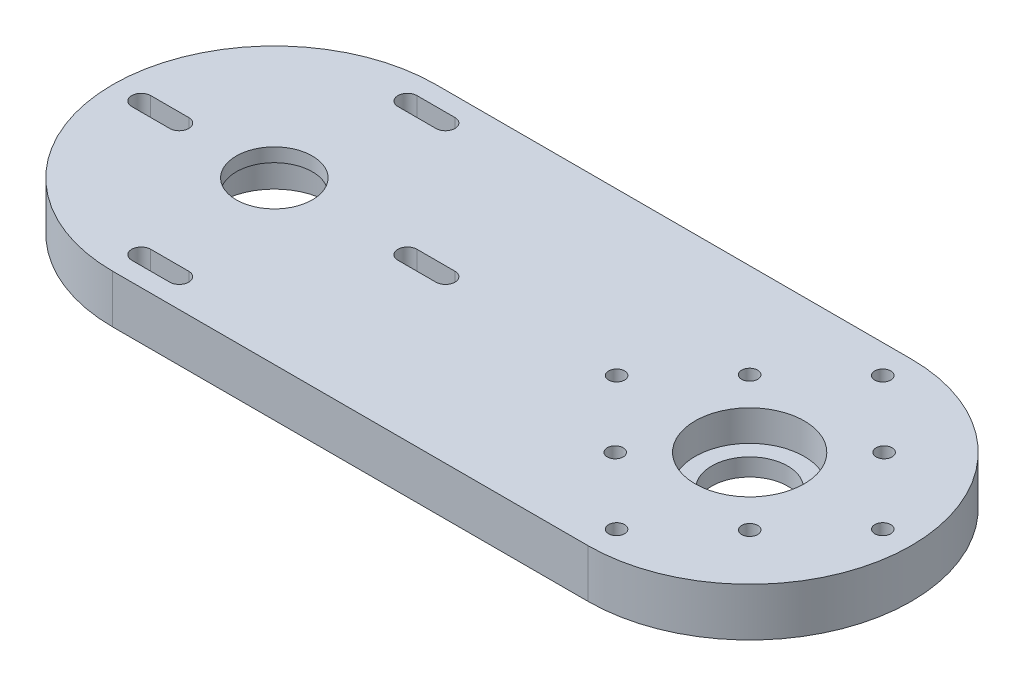
from build123d import *

# Parameters (mm, degrees)
SKETCH1_R           = 10
SKETCH1_R_2         = 2.1
BOSS_EXTRUDE1_DEPTH = 12.7
SKETCH2_R           = 14.35
CUT_EXTRUDE1_DEPTH  = 8.1
CUT_EXTRUDE2_START  = -12.7
SKETCH3_R           = 14.35
CUT_EXTRUDE2_DEPTH  = 9.1
CUT_EXTRUDE3_START  = -12.7
CUT_EXTRUDE3_DEPTH  = 5


with BuildPart() as part:
    # Sketch1 → Boss-Extrude1 (new body)
    with BuildSketch(Plane(origin=(0, 0, 0), x_dir=(1, 0, 0), z_dir=(0, 1, 0))):
        with BuildLine():
            ThreePointArc((-125, 42.5), (-167.5, 0), (-125, -42.5))
            Line((-125, -42.5), (0, -42.5))
            ThreePointArc((0, -42.5), (42.5, 0), (0, 42.5))
            Line((0, 42.5), (-125, 42.5))
        make_face()
        with BuildLine():
            Line((-90, 2.5), (-80, 2.5))
            ThreePointArc((-80, 2.5), (-77.5, 0), (-80, -2.5))
            Line((-80, -2.5), (-90, -2.5))
            ThreePointArc((-90, -2.5), (-92.5, 0), (-90, 2.5))
        make_face(mode=Mode.SUBTRACT)
        with BuildLine():
            ThreePointArc((-125, -37.5), (-127.5, -35), (-125, -32.5))
            Line((-125, -32.5), (-115, -32.5))
            ThreePointArc((-115, -32.5), (-112.5, -35), (-115, -37.5))
            Line((-115, -37.5), (-125, -37.5))
        make_face(mode=Mode.SUBTRACT)
        with BuildLine():
            ThreePointArc((-160, -2.5), (-162.5, 0), (-160, 2.5))
            Line((-160, 2.5), (-150, 2.5))
            ThreePointArc((-150, 2.5), (-147.5, 0), (-150, -2.5))
            Line((-150, -2.5), (-160, -2.5))
        make_face(mode=Mode.SUBTRACT)
        with Locations(Location((-125, 0, 0), (0, 0, 270))):
            Circle(SKETCH1_R, mode=Mode.SUBTRACT)
        with BuildLine():
            ThreePointArc((-125, 32.5), (-127.5, 35), (-125, 37.5))
            Line((-125, 37.5), (-115, 37.5))
            ThreePointArc((-115, 37.5), (-112.5, 35), (-115, 32.5))
            Line((-115, 32.5), (-125, 32.5))
        make_face(mode=Mode.SUBTRACT)
        with Locations(Location((0, 35, 0), (0, 0, 270))):
            Circle(SKETCH1_R_2, mode=Mode.SUBTRACT)
        with Locations(Location((0, -35, 0), (0, 0, 270))):
            Circle(SKETCH1_R_2, mode=Mode.SUBTRACT)
        with Locations(Location((-17.67766953, -17.67766953, 0), (0, 0, 270))):
            Circle(SKETCH1_R_2, mode=Mode.SUBTRACT)
        with Locations(Location((17.67766953, -17.67766953, 0), (0, 0, 270))):
            Circle(SKETCH1_R_2, mode=Mode.SUBTRACT)
        with Locations(Location((-35, 0, 0), (0, 0, 270))):
            Circle(SKETCH1_R_2, mode=Mode.SUBTRACT)
        with Locations(Location((-17.67766953, 17.67766953, 0), (0, 0, 270))):
            Circle(SKETCH1_R_2, mode=Mode.SUBTRACT)
        with Locations(Location((0, 0, 0), (0, 0, 270))):
            Circle(SKETCH1_R, mode=Mode.SUBTRACT)
        with Locations(Location((35, 0, 0), (0, 0, 270))):
            Circle(SKETCH1_R_2, mode=Mode.SUBTRACT)
        with Locations(Location((17.67766953, 17.67766953, 0), (0, 0, 270))):
            Circle(SKETCH1_R_2, mode=Mode.SUBTRACT)
    extrude(amount=-BOSS_EXTRUDE1_DEPTH)

    # Sketch2 → Cut-Extrude1 (cut)
    with BuildSketch(Plane(origin=(0, 0, 0), x_dir=(1, 0, 0), z_dir=(0, 1, 0))):
        with Locations(Location((0, 0, 0), (0, 0, 270))):
            Circle(SKETCH2_R)
    extrude(amount=-CUT_EXTRUDE1_DEPTH, mode=Mode.SUBTRACT)

    # Sketch3 → Cut-Extrude2 (cut)
    with BuildSketch(Plane(origin=(0, 0, 0), x_dir=(1, 0, 0), z_dir=(0, 1, 0)).offset(CUT_EXTRUDE2_START)):
        with Locations(Location((-125, 0, 0), (0, 0, 270))):
            Circle(SKETCH3_R)
    extrude(amount=CUT_EXTRUDE2_DEPTH, mode=Mode.SUBTRACT)

    # Sketch4 → Cut-Extrude3 (cut)
    with BuildSketch(Plane(origin=(0, 0, 0), x_dir=(1, 0, 0), z_dir=(0, 1, 0)).offset(CUT_EXTRUDE3_START)):
        with BuildLine():
            Line((-150, -4.05), (-160, -4.05))
            ThreePointArc((-160, -4.05), (-164.05, 0), (-160, 4.05))
            Line((-160, 4.05), (-150, 4.05))
            ThreePointArc((-150, 4.05), (-145.95, 0), (-150, -4.05))
        make_face()
        with BuildLine():
            Line((-125, -30.95), (-115, -30.95))
            ThreePointArc((-115, -30.95), (-110.95, -35), (-115, -39.05))
            Line((-115, -39.05), (-125, -39.05))
            ThreePointArc((-125, -39.05), (-129.05, -35), (-125, -30.95))
        make_face()
        with BuildLine():
            Line((-80, -4.05), (-90, -4.05))
            ThreePointArc((-90, -4.05), (-94.05, 0), (-90, 4.05))
            Line((-90, 4.05), (-80, 4.05))
            ThreePointArc((-80, 4.05), (-75.95, 0), (-80, -4.05))
        make_face()
        with BuildLine():
            Line((-125, 39.05), (-115, 39.05))
            ThreePointArc((-115, 39.05), (-110.95, 35), (-115, 30.95))
            Line((-115, 30.95), (-125, 30.95))
            ThreePointArc((-125, 30.95), (-129.05, 35), (-125, 39.05))
        make_face()
    extrude(amount=CUT_EXTRUDE3_DEPTH, mode=Mode.SUBTRACT)


solid = part.part
